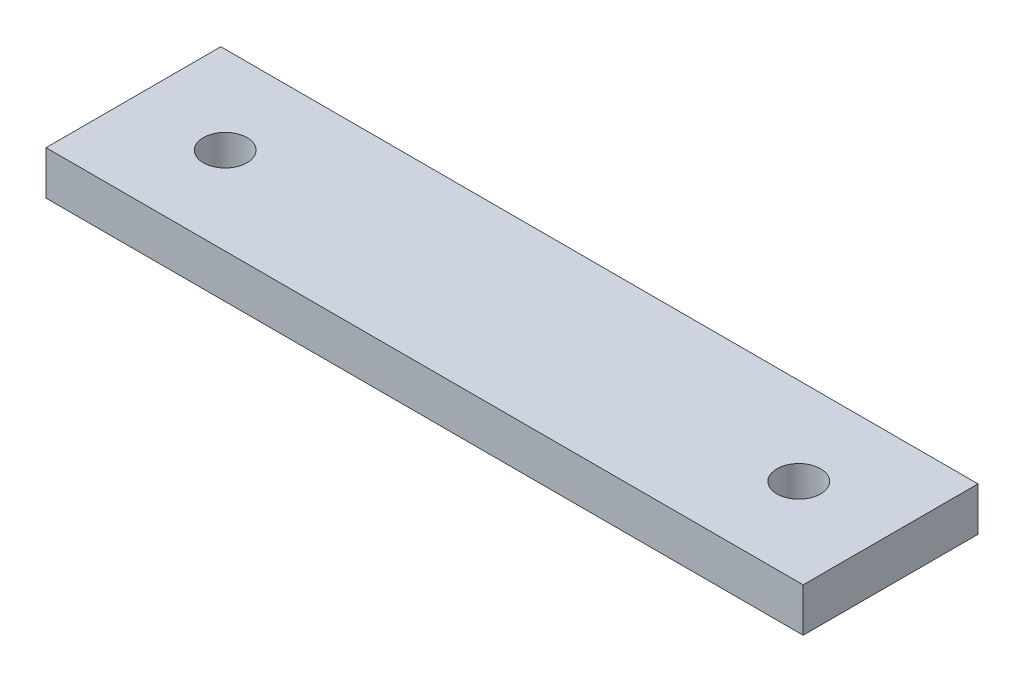
from build123d import *

# Parameters (mm, degrees)
SKETCH1_W           = 330
SKETCH1_H           = 76.2
SKETCH1_R           = 9.525
BOSS_EXTRUDE1_DEPTH = 19.05


with BuildPart() as part:
    # Sketch1 → Boss-Extrude1 (new body)
    with BuildSketch(Plane(origin=(0, 0, 0), x_dir=(1, 0, 0), z_dir=(0, 1, 0))):
        Rectangle(SKETCH1_W, SKETCH1_H)
        with Locations(Location((-125, 0, 0), (0, 0, 90))):
            Circle(SKETCH1_R, mode=Mode.SUBTRACT)
        with Locations(Location((125, 0, 0), (0, 0, 90))):
            Circle(SKETCH1_R, mode=Mode.SUBTRACT)
    extrude(amount=BOSS_EXTRUDE1_DEPTH)


solid = part.part
